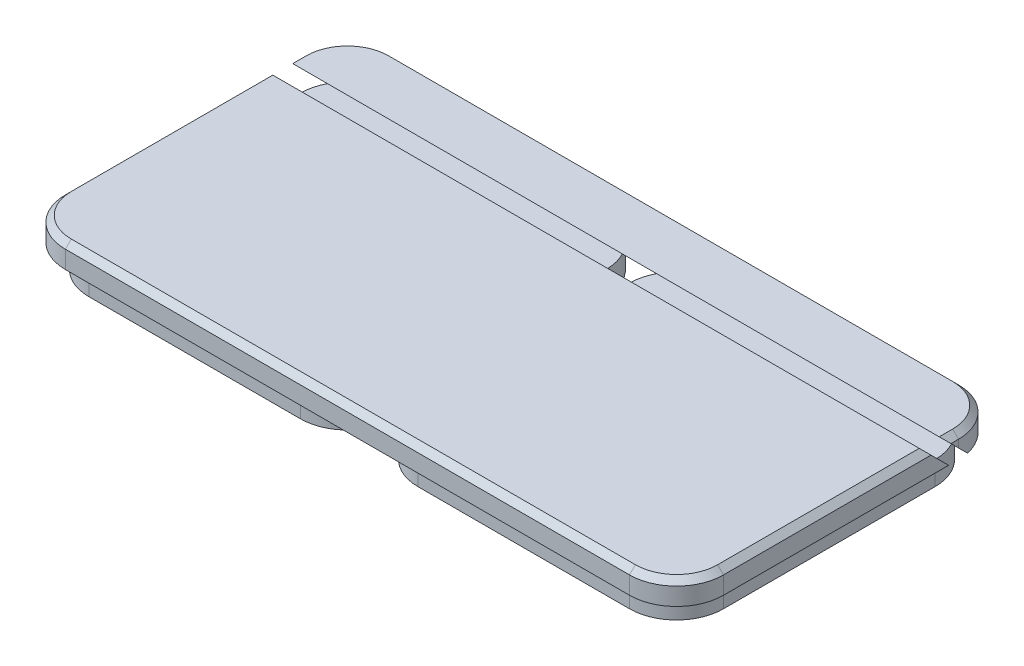
from build123d import *

# Parameters (mm, degrees)
BOSS_EXTRUDE4_DEPTH = 5
SKETCH6_W           = 70
SKETCH6_H           = 70
BOSS_EXTRUDE5_DEPTH = 5
SKETCH8_R           = 3
CUT_EXTRUDE1_DEPTH  = 2
FILLET1_R           = 10
CUT_EXTRUDE2_DEPTH  = 145.654761415
CHAMFER1_SIZE       = 1.25


with BuildPart() as part:
    # Sketch5 → Boss-Extrude4 (new body)
    with BuildSketch(Plane(origin=(0, 0, 0), x_dir=(1, 0, 0), z_dir=(0, 1, 0))):
        with BuildLine():
            Line((-22.5, -32.5), (22.5, -32.5))
            ThreePointArc((22.5, -32.5), (29.571067812, -29.571067812), (32.5, -22.5))
            Line((32.5, -22.5), (32.5, 22.5))
            ThreePointArc((32.5, 22.5), (29.571067812, 29.571067812), (22.5, 32.5))
            Line((22.5, 32.5), (-22.5, 32.5))
            ThreePointArc((-22.5, 32.5), (-29.571067812, 29.571067812), (-32.5, 22.5))
            Line((-32.5, 22.5), (-32.5, -22.5))
            ThreePointArc((-32.5, -22.5), (-29.571067812, -29.571067812), (-22.5, -32.5))
        make_face()
    extrude(amount=BOSS_EXTRUDE4_DEPTH)

    # Sketch6 → Boss-Extrude5 (add)
    with BuildSketch(Plane(origin=(0, 5, 0), x_dir=(1, 0, 0), z_dir=(0, 1, 0))):
        Rectangle(SKETCH6_W, SKETCH6_H)
    extrude(amount=BOSS_EXTRUDE5_DEPTH)

    # Sketch8 → Cut-Extrude1 (cut)
    with BuildSketch(Plane.XZ):
        with Locations(Location((26.037533906, -26.035533906, 0), (0, 0, 270))):
            Circle(SKETCH8_R)
        with Locations(Location((26.036533906, 26.036533906, 0), (0, 0, 270))):
            Circle(SKETCH8_R)
        with BuildLine():
            ThreePointArc((-23.035533906, 26.035533906), (-24.887483609, 28.807172503), (-28.156854249, 28.156854249))
            Line((-28.156854249, 28.156854249), (-23.914213562, 23.914213562))
            ThreePointArc((-23.914213562, 23.914213562), (-23.263895308, 24.887483609), (-23.035533906, 26.035533906))
        make_face()
        with BuildLine():
            Line((-23.914213562, 23.914213562), (-28.156854249, 28.156854249))
            ThreePointArc((-28.156854249, 28.156854249), (-28.156854249, 23.914213562), (-23.914213562, 23.914213562))
        make_face()
        with Locations(Location((-26.034533906, -26.036533906, 0), (0, 0, 270))):
            Circle(SKETCH8_R)
    extrude(amount=-CUT_EXTRUDE1_DEPTH, mode=Mode.SUBTRACT)

    # Mirror1: part across plane


with BuildPart() as part_1:
    add(part.part)
    add(part.part.mirror(Plane(origin=(-35, 10, -35), x_dir=(0, 0, 1), z_dir=(1, 0, 0))))

    # Fillet1
    fillet1_edges = [part_1.edges().sort_by_distance(p)[0] for p in [
        (35, 7.5, 35),
        (35, 7.5, -35),
        (-105, 7.5, 35),
        (-105, 7.5, -35),
    ]]
    fillet(fillet1_edges, radius=FILLET1_R)

    # Sketch9 → Cut-Extrude2 (cut, through all)
    with BuildSketch(Plane(origin=(35, 0, 0), x_dir=(0, 0, -1), z_dir=(1, 0, 0))):
        Polygon((17.878679656, 10), (22.121320344, 10), (26.060660172, 6.060660172), (27.121320344, 5), (22.878679656, 5), (18.939339828, 8.939339828), align=None)
    extrude(amount=-CUT_EXTRUDE2_DEPTH, mode=Mode.SUBTRACT)

    # Chamfer1
    chamfer1_edges = [part_1.edges().sort_by_distance(p)[0] for p in [
        (-105, 10, 3.560660172),
        (-35, 10, -35),
        (-35, 10, 35),
        (35, 10, 3.560660172),
        (32.071067812, 10, -32.071067812),
        (32.071067812, 10, 32.071067812),
        (-102.071067812, 10, 32.071067812),
        (-102.071067812, 10, -32.071067812),
        (-105, 10, -23.560660172),
        (35, 10, -23.560660172),
    ]]
    chamfer(chamfer1_edges, length=CHAMFER1_SIZE)


solid = part_1.part
